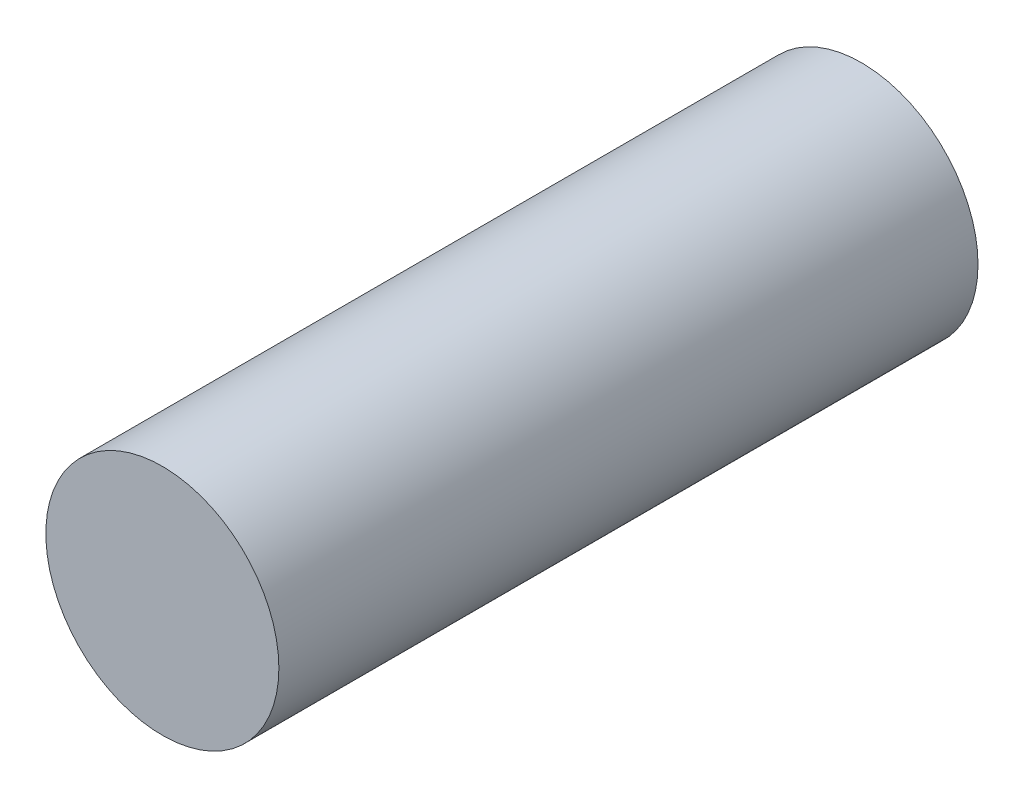
from build123d import *

# Parameters (mm, degrees)
SKIZZE1_R                       = 4
AUFSATZ_LINEAR_AUSTRAGEN1_DEPTH = 24


with BuildPart() as part:
    # Skizze1 → Aufsatz-Linear austragen1 (new body)
    with BuildSketch(Plane.XY):
        Circle(SKIZZE1_R)
    extrude(amount=AUFSATZ_LINEAR_AUSTRAGEN1_DEPTH)


solid = part.part
